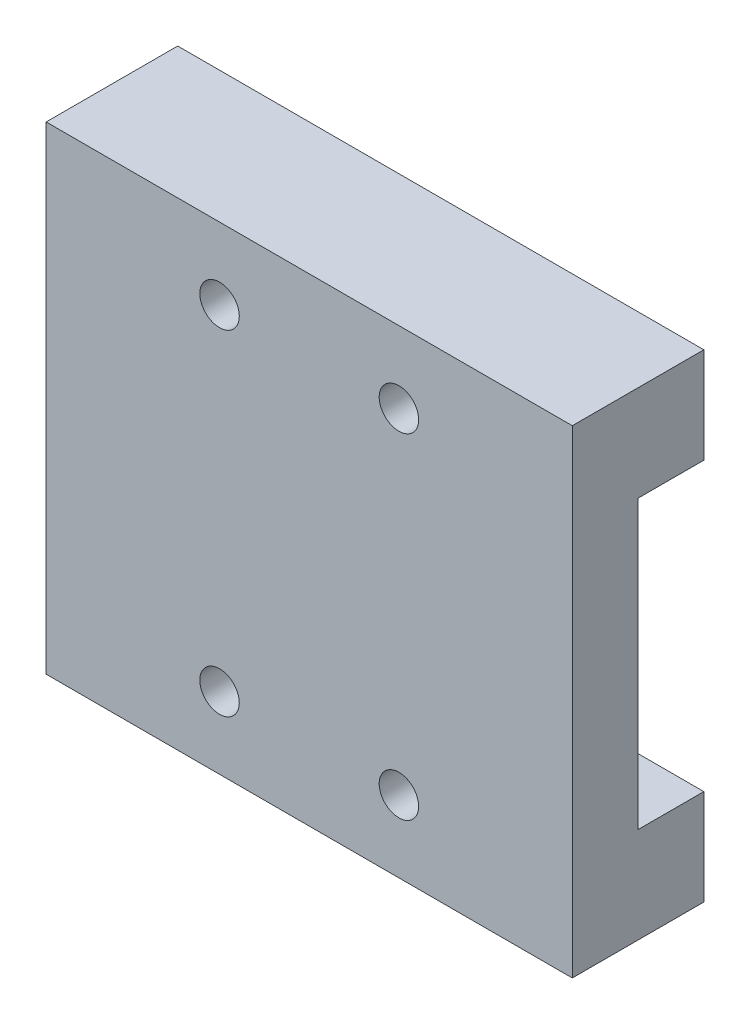
from build123d import *

# Parameters (mm, degrees)
SKETCH_1_W             = 44
SKETCH_1_H             = 40
EXTRUDE_1_DEPTH        = 11
SKETCH_2_W             = 5.5
SKETCH_2_H             = 24
CUT_EXTRUDE_1_DEPTH    = 61.473134531
HOLE_WIZARD_M4_1_D     = 3.3
HOLE_WIZARD_M4_1_DEPTH = 10.1
HOLE_WIZARD_M4_1_TIP   = 0.991420021


with BuildPart() as part:
    # 草图1 → 凸台-拉伸1 (new body)
    with BuildSketch(Plane.XY):
        with Locations((22, 20)):
            Rectangle(SKETCH_1_W, SKETCH_1_H)
    extrude(amount=EXTRUDE_1_DEPTH)

    # 草图2 → 切除-拉伸1 (cut, through all)
    with BuildSketch(Plane.ZY):
        with Locations((2.75, 20)):
            Rectangle(SKETCH_2_W, SKETCH_2_H)
    extrude(amount=-CUT_EXTRUDE_1_DEPTH, mode=Mode.SUBTRACT)

    # M4 螺纹孔1
    with Locations(Plane.XY.offset(11)):
        with Locations((14.5, 34), (29.5, 34), (14.5, 6), (29.5, 6)):
            Hole(HOLE_WIZARD_M4_1_D / 2, depth=HOLE_WIZARD_M4_1_DEPTH)
            with Locations((0, 0, -(HOLE_WIZARD_M4_1_DEPTH + HOLE_WIZARD_M4_1_TIP / 2))):  # 118° drill point
                Cone(0, HOLE_WIZARD_M4_1_D / 2, HOLE_WIZARD_M4_1_TIP, mode=Mode.SUBTRACT)


solid = part.part
